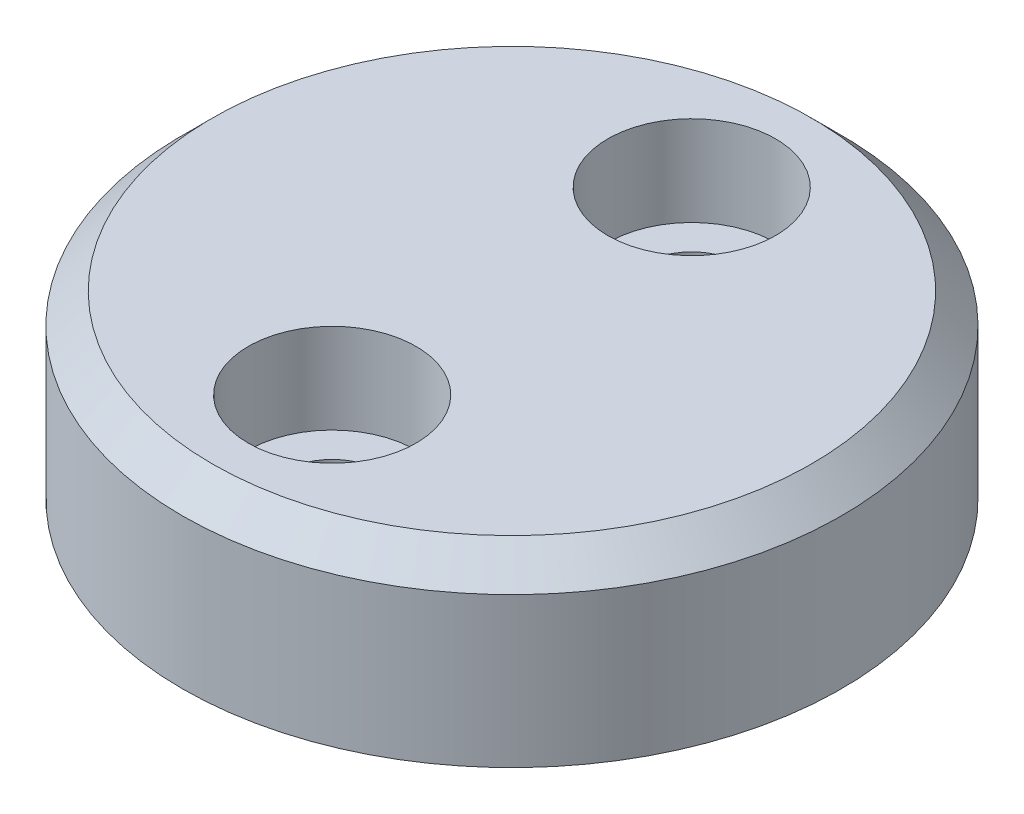
from build123d import *

# Parameters (mm, degrees)
ESQUISSE1_R             = 10
BOSS_EXTRU_1_DEPTH      = 0.5
ESQUISSE2_R             = 11
BOSS_EXTRU_2_DEPTH      = 6
CHANFREIN1_SIZE         = 1
ESQUISSE3_R             = 1.6
ENL_V_MAT_EXTRU_1_DEPTH = 17.8597153
ESQUISSE4_R             = 2.8
ENL_V_MAT_EXTRU_2_DEPTH = 3


with BuildPart() as part:
    # Esquisse1 → Boss.-Extru.1 (new body)
    with BuildSketch(Plane(origin=(0, 0, 0), x_dir=(1, 0, 0), z_dir=(0, 1, 0))):
        with Locations(Location((0, 0, 0), (0, 0, 270))):
            Circle(ESQUISSE1_R)
    extrude(amount=BOSS_EXTRU_1_DEPTH)

    # Esquisse2 → Boss.-Extru.2 (add)
    with BuildSketch(Plane(origin=(0, 0.5, 0), x_dir=(1, 0, 0), z_dir=(0, 1, 0))):
        with Locations(Location((0, 0, 0), (0, 0, 270))):
            Circle(ESQUISSE2_R)
    extrude(amount=BOSS_EXTRU_2_DEPTH)

    # Chanfrein1
    chanfrein1_edges = [part.edges().sort_by_distance(p)[0] for p in [
        (0, 6.5, -11),
    ]]
    chamfer(chanfrein1_edges, length=CHANFREIN1_SIZE)

    # Esquisse3 → Enlèv. mat.-Extru.1 (cut, through all)
    with BuildSketch(Plane(origin=(0, 6.5, 0), x_dir=(1, 0, 0), z_dir=(0, 1, 0))):
        with Locations(Location((0, 6, 0), (0, 0, 270))):
            Circle(ESQUISSE3_R)
        with Locations(Location((0, -6, 0), (0, 0, 270))):
            Circle(ESQUISSE3_R)
    extrude(amount=-ENL_V_MAT_EXTRU_1_DEPTH, mode=Mode.SUBTRACT)

    # Esquisse4 → Enlèv. mat.-Extru.2 (cut)
    with BuildSketch(Plane(origin=(0, 6.5, 0), x_dir=(1, 0, 0), z_dir=(0, 1, 0))):
        with Locations(Location((0, 6, 0), (0, 0, 270))):
            Circle(ESQUISSE4_R)
        with Locations(Location((0, -6, 0), (0, 0, 270))):
            Circle(ESQUISSE4_R)
    extrude(amount=-ENL_V_MAT_EXTRU_2_DEPTH, mode=Mode.SUBTRACT)


solid = part.part
